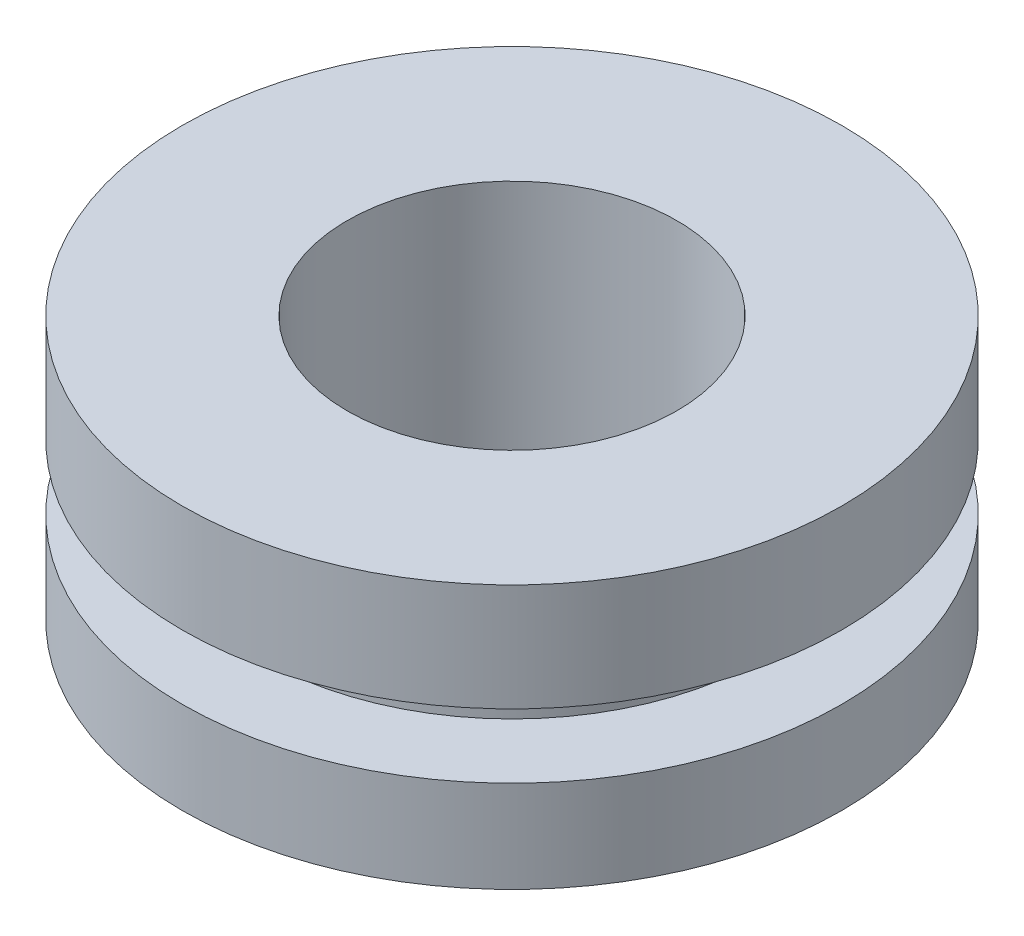
from build123d import *

# Parameters (mm, degrees)
SKETCH_1_R      = 5
SKETCH_1_R_2    = 2.5
EXTRUDE_1_DEPTH = 4
SKETCH_2_W      = 1.193229727
SKETCH_2_H      = 0.975939513


with BuildPart() as part:
    # 草图1 → 凸台-拉伸1 (new body)
    with BuildSketch(Plane(origin=(0, 0, 0), x_dir=(1, 0, 0), z_dir=(0, 1, 0))):
        with Locations(Location((0, 0, 0), (0, 0, 270))):
            Circle(SKETCH_1_R)
        with Locations(Location((0, 0, 0), (0, 0, 270))):
            Circle(SKETCH_1_R_2, mode=Mode.SUBTRACT)
    extrude(amount=EXTRUDE_1_DEPTH)

    # 草图2 → 切除-旋转1 (revolve, cut)
    with BuildSketch(Plane.XY, mode=Mode.PRIVATE) as cut_revolve_1_sk:
        with Locations((-4.403385136, 1.883358194)):
            Rectangle(SKETCH_2_W, SKETCH_2_H)
    revolve(cut_revolve_1_sk.sketch.rotate(Axis((0, 4, 0), (0, -1, 0)), 270), axis=Axis((0, 4, 0), (0, -1, 0)), mode=Mode.SUBTRACT)


solid = part.part
